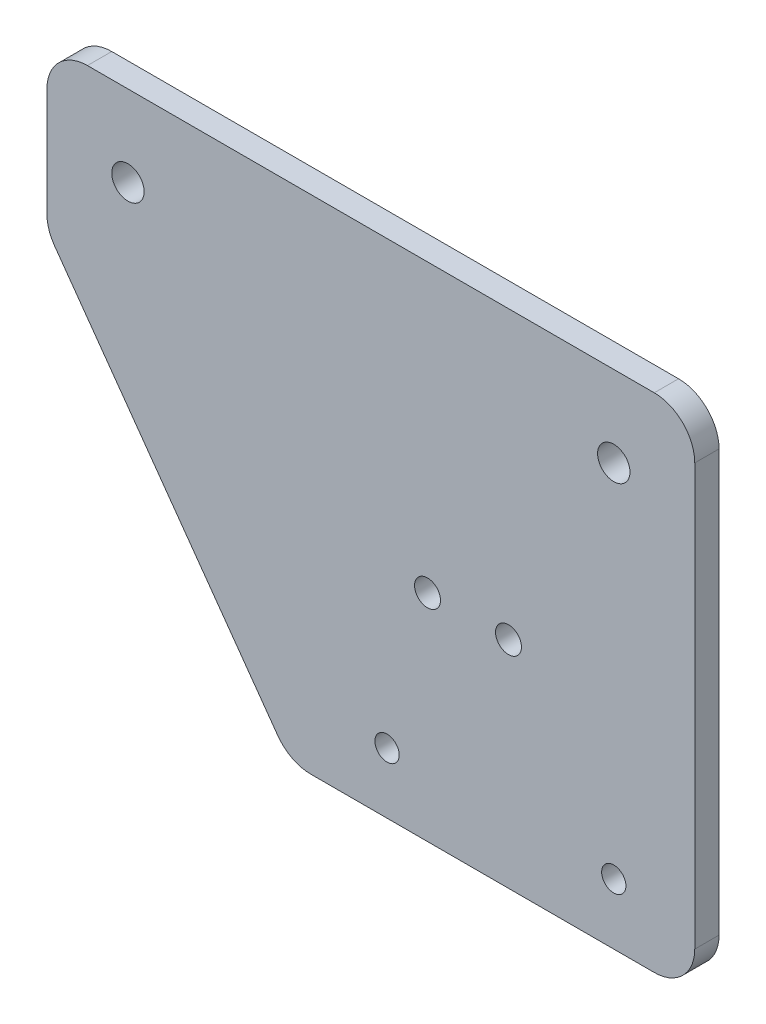
from build123d import *

# Parameters (mm, degrees)
SKETCH_1_W              = 80
SKETCH_1_H              = 62
EXTRUDE_1_DEPTH         = 3
HOLE_WIZARD_4_0_4_1_D   = 4
HOLE_WIZARD_3_2_3_2_1_D = 3.2
CUT_EXTRUDE_1_DEPTH     = 3
HOLE_WIZARD_3_0_3_1_D   = 3
FILLET_1_R              = 5


with BuildPart() as part:
    # 草图1 → 凸台-拉伸1 (new body)
    with BuildSketch(Plane.XY):
        with Locations((-2.5, 0)):
            Rectangle(SKETCH_1_W, SKETCH_1_H)
    extrude(amount=EXTRUDE_1_DEPTH)

    # Ø4.0 (4) 直径孔1 (through all)
    with Locations(Plane.XY.offset(3)):
        with Locations((27.5, 21), (-32.5, 21)):
            Hole(HOLE_WIZARD_4_0_4_1_D / 2)

    # Ø3.2 (3.2) 直径孔1 (through all)
    with Locations(Plane.XY.offset(3)):
        with Locations((14.5, -4.4), (4.5, -4.4)):
            Hole(HOLE_WIZARD_3_2_3_2_1_D / 2)

    # 草图6 → 切除-拉伸1 (cut)
    with BuildSketch(Plane.XY.offset(3)):
        Polygon((-42.5, 11), (-42.5, -31), (-12.5, -31), align=None)
    extrude(amount=-CUT_EXTRUDE_1_DEPTH, mode=Mode.SUBTRACT)

    # Ø3.0 (3) 直径孔1 (through all)
    with Locations(Plane.XY.offset(3)):
        with Locations((27.5, -23.5), (-0.5, -23.5)):
            Hole(HOLE_WIZARD_3_0_3_1_D / 2)

    # 圆角1
    fillet_1_edges = [part.edges().sort_by_distance(p)[0] for p in [
        (-42.5, 11, 1.5),
        (-12.5, -31, 1.5),
        (37.5, -31, 1.5),
        (-42.5, 31, 1.5),
        (37.5, 31, 1.5),
    ]]
    fillet(fillet_1_edges, radius=FILLET_1_R)


solid = part.part
